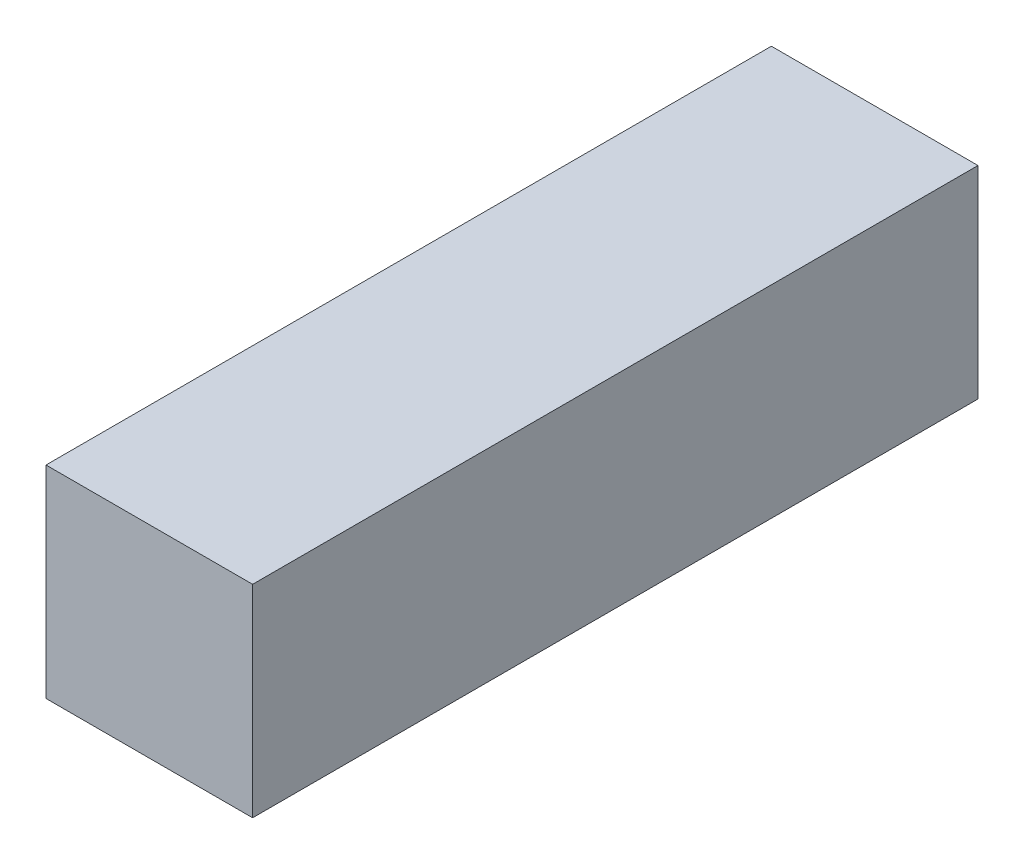
from build123d import *

# Parameters (mm, degrees)
SKETCH_1_W      = 47
SKETCH_1_H      = 165
EXTRUDE_1_DEPTH = 46


with BuildPart() as part:
    # 草图1 → 凸台-拉伸1 (new body)
    with BuildSketch(Plane(origin=(0, 0, 0), x_dir=(1, 0, 0), z_dir=(0, 1, 0))):
        Rectangle(SKETCH_1_W, SKETCH_1_H)
    extrude(amount=EXTRUDE_1_DEPTH)


solid = part.part
